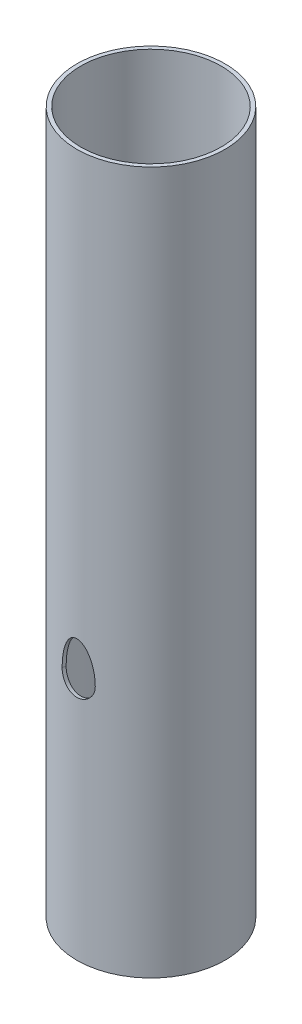
from build123d import *

# Parameters (mm, degrees)
SKETCH2_R           = 38
SKETCH2_R_2         = 36
BOSS_EXTRUDE1_DEPTH = 360
CUT_EXTRUDE1_REACH  = 365.989


with BuildPart() as part:
    # Sketch2 → Boss-Extrude1 (new body)
    with BuildSketch(Plane(origin=(0, 0, 0), x_dir=(1, 0, 0), z_dir=(0, 1, 0))):
        Circle(SKETCH2_R)
        Circle(SKETCH2_R_2, mode=Mode.SUBTRACT)
    extrude(amount=BOSS_EXTRUDE1_DEPTH)

    # Sketch3 → Cut-Extrude1 (cut, up to next)
    with BuildSketch(Plane(origin=(0, 0, 0), x_dir=(-1, 0, 0), z_dir=(0, 0.20449605184179045, 0.978867388761685)), mode=Mode.PRIVATE) as cut_extrude1_sk1:
        with BuildLine():
            ThreePointArc((8.5, -115), (0, -106.5), (-8.5, -115))
            add(Edge.make_bspline(
                [(-8.5, -115), (-8.5, -132), (0, -132), (8.5, -132), (8.5, -115)],
                knots=[4.71238898, 4.71238898, 4.71238898, 6.283185307, 6.283185307, 7.853981634, 7.853981634, 7.853981634], degree=2, weights=[1, 0.707106781, 1, 0.707106781, 1]))
        make_face()
    cut_extrude1_tool1 = extrude(cut_extrude1_sk1.sketch, amount=CUT_EXTRUDE1_REACH, mode=Mode.PRIVATE) & part.part
    add(cut_extrude1_tool1.solids().sort_by_distance((0, 116.09976, -24.254504))[0], mode=Mode.SUBTRACT)


solid = part.part
